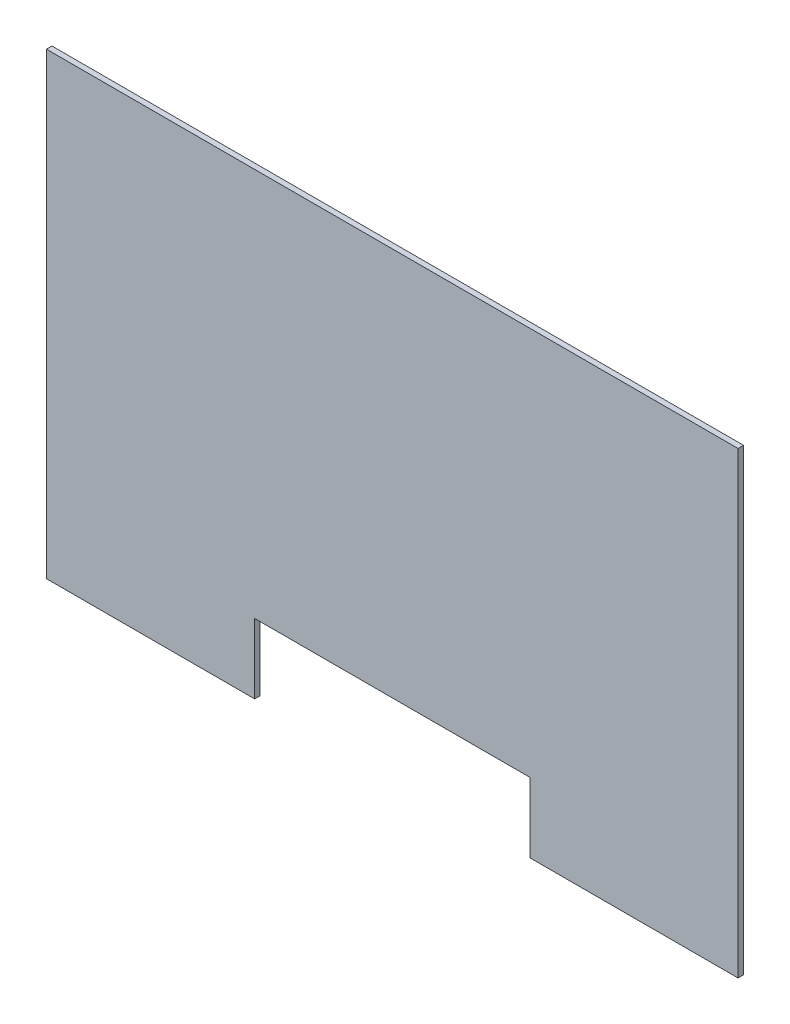
from build123d import *

# Parameters (mm, degrees)
SKETCH1_W           = 37.7
SKETCH1_H           = 25
BOSS_EXTRUDE1_DEPTH = 0.3
CUT_EXTRUDE1_REACH  = 24.62
SKETCH2_W           = 15
SKETCH2_H           = 6


with BuildPart() as part:
    # Sketch1 → Boss-Extrude1 (new body)
    with BuildSketch(Plane.XY):
        Rectangle(SKETCH1_W, SKETCH1_H)
    extrude(amount=BOSS_EXTRUDE1_DEPTH)

    # Sketch2 → Cut-Extrude1 (cut, up to next)
    with BuildSketch(Plane.XY.offset(0.3), mode=Mode.PRIVATE) as cut_extrude1_sk1:
        with Locations((0, -11.7)):
            Rectangle(SKETCH2_W, SKETCH2_H)
    cut_extrude1_tool1 = extrude(cut_extrude1_sk1.sketch, amount=-CUT_EXTRUDE1_REACH, mode=Mode.PRIVATE) & part.part
    add(cut_extrude1_tool1.solids().sort_by_distance((0, -11.7, 0.3))[0], mode=Mode.SUBTRACT)


solid = part.part
